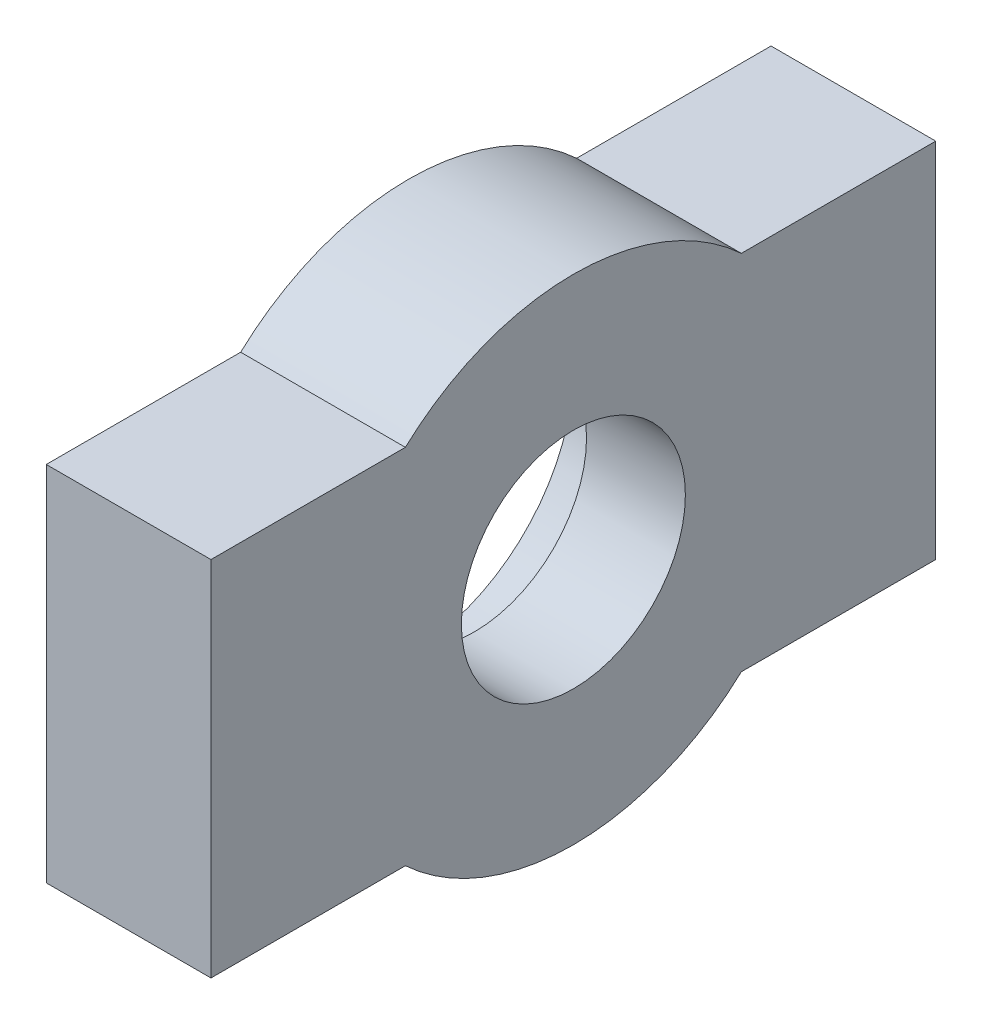
from build123d import *

# Parameters (mm, degrees)
SKETCH_1_R          = 7.5
EXTRUDE_1_DEPTH     = 5
SKETCH_2_R          = 5
CUT_EXTRUDE_1_DEPTH = 2
SKETCH_3_R          = 3.4
CUT_EXTRUDE_2_DEPTH = 12.022703843
SKETCH_4_W          = 6
SKETCH_4_H          = 11
EXTRUDE_2_DEPTH     = 5


with BuildPart() as part:
    # 草图1 → 凸台-拉伸1 (new body)
    with BuildSketch(Plane(origin=(0, 0, 0), x_dir=(0, 0, -1), z_dir=(1, 0, 0))):
        Circle(SKETCH_1_R)
    extrude(amount=EXTRUDE_1_DEPTH)

    # 草图2 → 切除-拉伸1 (cut)
    with BuildSketch(Plane.ZY):
        Circle(SKETCH_2_R)
    extrude(amount=-CUT_EXTRUDE_1_DEPTH, mode=Mode.SUBTRACT)

    # 草图3 → 切除-拉伸2 (cut, through all)
    with BuildSketch(Plane.ZY.offset(-2)):
        Circle(SKETCH_3_R)
    extrude(amount=-CUT_EXTRUDE_2_DEPTH, mode=Mode.SUBTRACT)

    # 草图4 → 凸台-拉伸2 (add)
    with BuildSketch(Plane.ZY):
        with Locations((8, 0)):
            Rectangle(SKETCH_4_W, SKETCH_4_H)
        with Locations((-8, 0)):
            Rectangle(SKETCH_4_W, SKETCH_4_H)
    extrude(amount=-EXTRUDE_2_DEPTH)


solid = part.part
